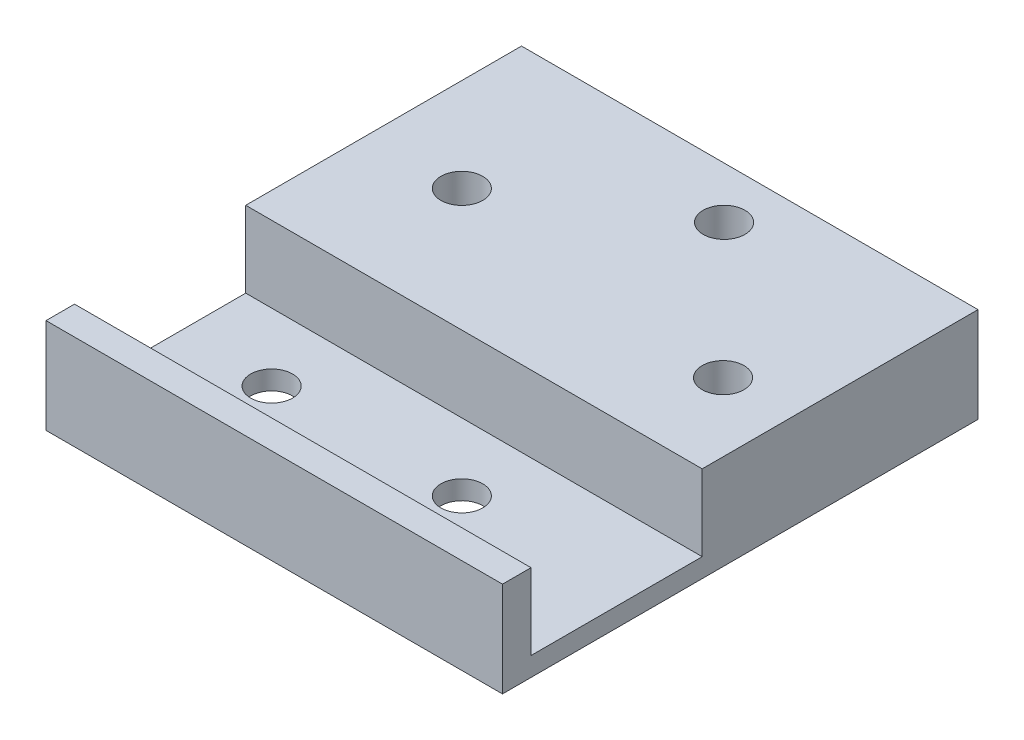
from build123d import *

# Parameters (mm, degrees)
SKETCH1_W           = 120
SKETCH1_H           = 55
BOSS_EXTRUDE1_DEPTH = 5
SKETCH2_W           = 120
SKETCH2_H           = 7.5
BOSS_EXTRUDE2_DEPTH = 20
SKETCH3_W           = 120
SKETCH3_H           = 2.5
BOSS_EXTRUDE4_DEPTH = 20
BOSS_EXTRUDE5_DEPTH = 190
SKETCH9_W           = 310
SKETCH9_H           = 25
BOSS_EXTRUDE6_DEPTH = 70
SKETCH14_R          = 5.5
CUT_EXTRUDE5_DEPTH  = 153
SKETCH15_W          = 125
SKETCH15_H          = 25
CUT_EXTRUDE6_DEPTH  = 190


with BuildPart() as part:
    # Sketch1 → Boss-Extrude1 (new body)
    with BuildSketch(Plane(origin=(0, 0, 0), x_dir=(1, 0, 0), z_dir=(0, 1, 0))):
        Rectangle(SKETCH1_W, SKETCH1_H)
    extrude(amount=BOSS_EXTRUDE1_DEPTH)

    # Sketch2 → Boss-Extrude2 (add)
    with BuildSketch(Plane(origin=(0, 5, 0), x_dir=(1, 0, 0), z_dir=(0, 1, 0))):
        with Locations((0, -23.75)):
            Rectangle(SKETCH2_W, SKETCH2_H)
    extrude(amount=BOSS_EXTRUDE2_DEPTH)

    # Sketch3 → Boss-Extrude4 (add)
    with BuildSketch(Plane(origin=(0, 5, 0), x_dir=(1, 0, 0), z_dir=(0, 1, 0))):
        with Locations((0, 26.25)):
            Rectangle(SKETCH3_W, SKETCH3_H)
    extrude(amount=BOSS_EXTRUDE4_DEPTH)

    # Sketch8 → Boss-Extrude5 (add)
    with BuildSketch(Plane.ZY.offset(60)):
        Polygon((-27.5, 0), (-27.5, 25), (-25, 25), (-25, 5), (20, 5), (20, 25), (27.5, 25), (27.5, 0), align=None)
    extrude(amount=BOSS_EXTRUDE5_DEPTH)

    # Sketch9 → Boss-Extrude6 (add)
    with BuildSketch(Plane(origin=(0, 0, -27.5), x_dir=(-1, 0, 0), z_dir=(0, 0, -1))):
        with Locations((95, 12.5)):
            Rectangle(SKETCH9_W, SKETCH9_H)
    extrude(amount=BOSS_EXTRUDE6_DEPTH)

    # Sketch14 → Cut-Extrude5 (cut)
    with BuildSketch(Plane(origin=(0, 0, 0), x_dir=(-1, 0, 0), z_dir=(0, -1, 0))):
        with Locations(Location((225.445279058, 7.255161462, 0), (0, 0, 90))):
            Circle(SKETCH14_R)
        with Locations(Location((175.445279058, 7.255161462, 0), (0, 0, 90))):
            Circle(SKETCH14_R)
        with Locations(Location((225.445279058, 57.255161462, 0), (0, 0, 90))):
            Circle(SKETCH14_R)
        with Locations(Location((148.0182107, 48.5, 0), (0, 0, 90))):
            Circle(SKETCH14_R)
        with Locations(Location((183.240850763, 83.987541856, 0), (0, 0, 90))):
            Circle(SKETCH14_R)
    extrude(amount=-CUT_EXTRUDE5_DEPTH, mode=Mode.SUBTRACT)

    # Sketch15 → Cut-Extrude6 (cut)
    with BuildSketch(Plane(origin=(60, 0, 0), x_dir=(0, 0, -1), z_dir=(1, 0, 0))):
        with Locations((35, 12.5)):
            Rectangle(SKETCH15_W, SKETCH15_H)
    extrude(amount=-CUT_EXTRUDE6_DEPTH, mode=Mode.SUBTRACT)


solid = part.part
